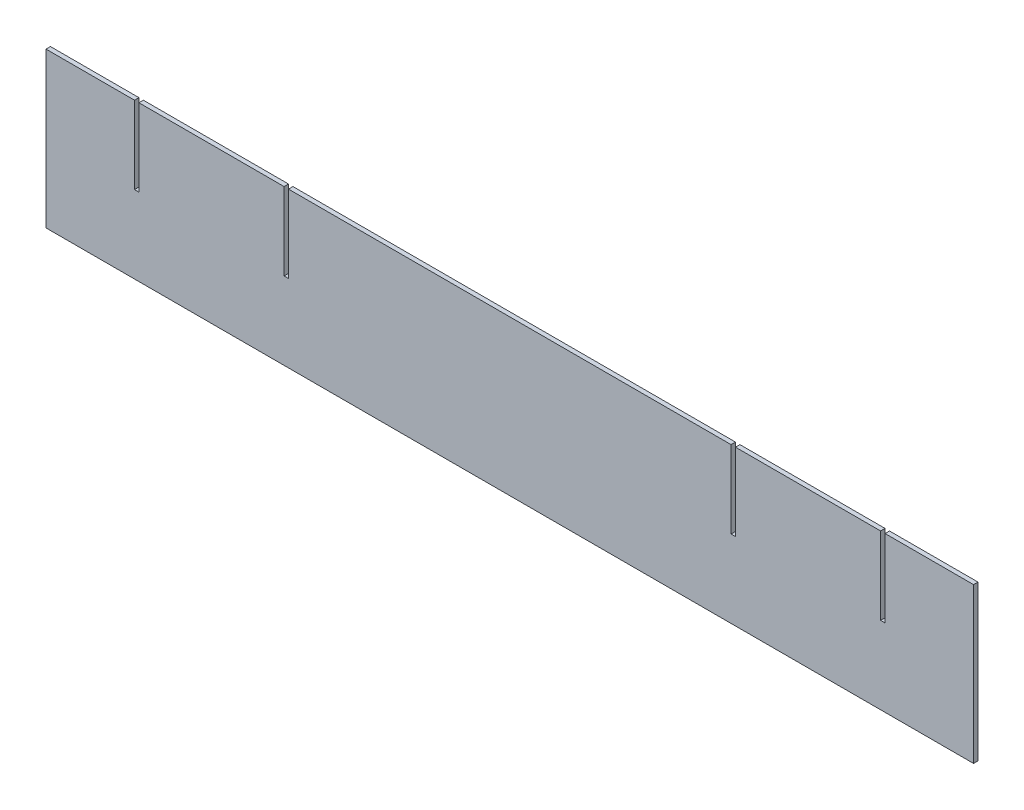
from build123d import *

# Parameters (mm, degrees)
SKETCH_1_W          = 419.2
SKETCH_1_H          = 70
EXTRUDE_1_DEPTH     = 2
SKETCH_2_W          = 2
SKETCH_2_H          = 35
CUT_EXTRUDE_1_DEPTH = 2


with BuildPart() as part:
    # 草图1 → 凸台-拉伸1 (new body)
    with BuildSketch(Plane.XY):
        Rectangle(SKETCH_1_W, SKETCH_1_H)
    extrude(amount=EXTRUDE_1_DEPTH)

    # 草图2 → 切除-拉伸1 (cut)
    with BuildSketch(Plane.XY.offset(2)):
        with Locations((168.6, 17.5)):
            Rectangle(SKETCH_2_W, SKETCH_2_H)
        with Locations((101, 17.5)):
            Rectangle(SKETCH_2_W, SKETCH_2_H)
        with Locations((-101, 17.5)):
            Rectangle(SKETCH_2_W, SKETCH_2_H)
        with Locations((-168.6, 17.5)):
            Rectangle(SKETCH_2_W, SKETCH_2_H)
    extrude(amount=-CUT_EXTRUDE_1_DEPTH, mode=Mode.SUBTRACT)


solid = part.part
